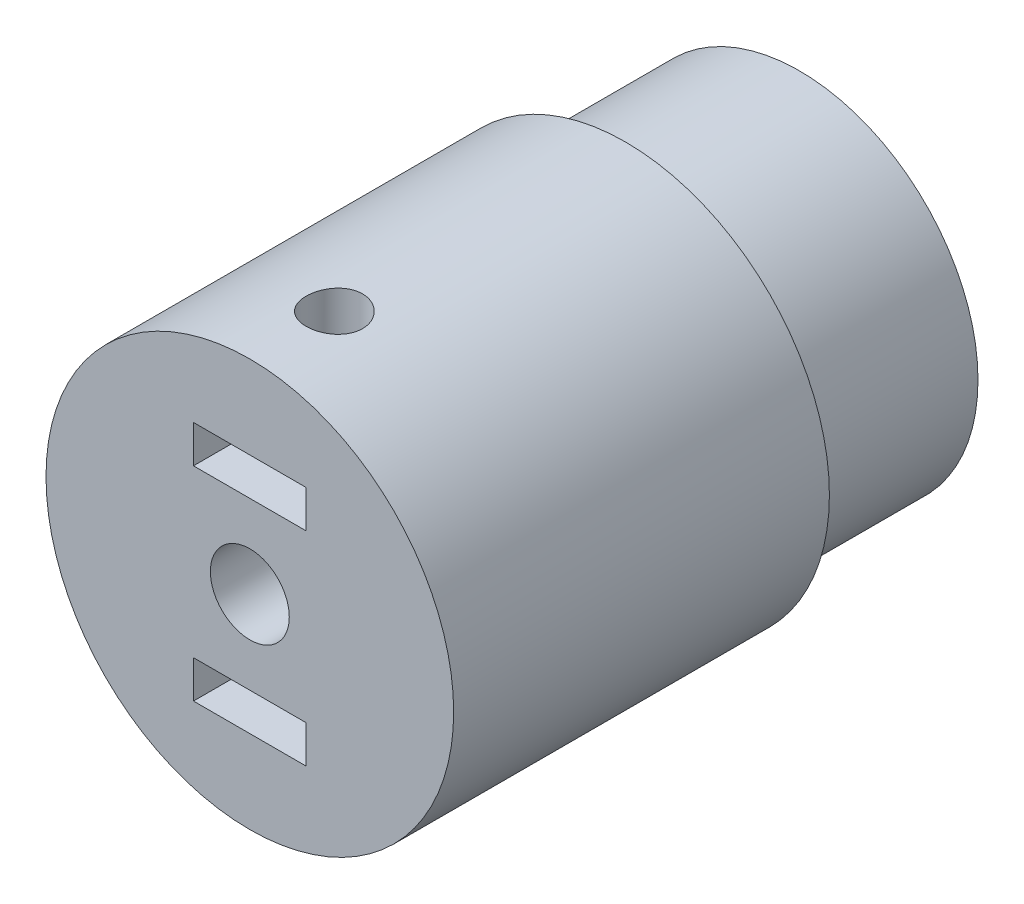
from build123d import *

# Parameters (mm, degrees)
SKETCH1_R           = 9.5
SKETCH1_R_2         = 2.1
BOSS_EXTRUDE1_DEPTH = 9.26
SKETCH2_R           = 10.85
SKETCH2_R_2         = 2.1
BOSS_EXTRUDE2_DEPTH = 20
SKETCH3_W           = 6
SKETCH3_H           = 2
CUT_EXTRUDE1_DEPTH  = 12
SKETCH4_R           = 1.5
CUT_EXTRUDE2_DEPTH  = 39.01
SKETCH5_R           = 1.5
CUT_EXTRUDE3_DEPTH  = 12


with BuildPart() as part:
    # Sketch1 → Boss-Extrude1 (new body)
    with BuildSketch(Plane.XY):
        Circle(SKETCH1_R)
        Circle(SKETCH1_R_2, mode=Mode.SUBTRACT)
    extrude(amount=BOSS_EXTRUDE1_DEPTH)

    # Sketch2 → Boss-Extrude2 (add)
    with BuildSketch(Plane.XY.offset(9.26)):
        Circle(SKETCH2_R)
        Circle(SKETCH2_R_2, mode=Mode.SUBTRACT)
    extrude(amount=BOSS_EXTRUDE2_DEPTH)

    # Sketch3 → Cut-Extrude1 (cut)
    with BuildSketch(Plane.XY.offset(29.26)):
        with Locations((0, 5.422033923)):
            Rectangle(SKETCH3_W, SKETCH3_H)
        with Locations((0, -5.422033923)):
            Rectangle(SKETCH3_W, SKETCH3_H)
    extrude(amount=-CUT_EXTRUDE1_DEPTH, mode=Mode.SUBTRACT)

    # Sketch4 → Cut-Extrude2 (cut, through all)
    with BuildSketch(Plane(origin=(0, 10.85, 0), x_dir=(1, 0, 0), z_dir=(0, 1, 0))):
        with Locations(Location((0, -24.76, 0), (0, 0, 180))):
            Circle(SKETCH4_R)
    extrude(amount=-CUT_EXTRUDE2_DEPTH, mode=Mode.SUBTRACT)

    # Sketch5 → Cut-Extrude3 (cut)
    with BuildSketch(Plane(origin=(0, 0, 0), x_dir=(-1, 0, 0), z_dir=(0, 0, -1))):
        with Locations((0, 6)):
            Circle(SKETCH5_R)
        with Locations((5.196152423, -3)):
            Circle(SKETCH5_R)
        with Locations((-5.196152423, -3)):
            Circle(SKETCH5_R)
    extrude(amount=-CUT_EXTRUDE3_DEPTH, mode=Mode.SUBTRACT)


solid = part.part
